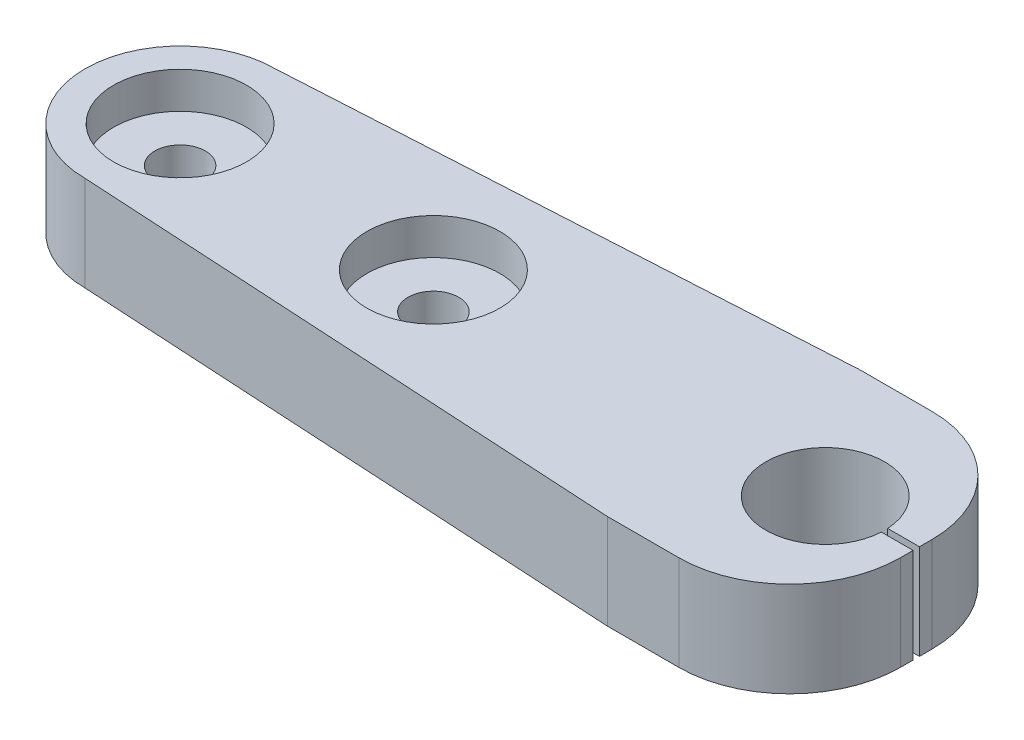
from build123d import *

# Parameters (mm, degrees)
SKETCH1_R                                        = 1.5
BOSS_EXTRUDE1_DEPTH                              = 6
CBORE_FOR_M3_HEX_HEAD_MACHINE_SCREW1_D           = 3.2
CBORE_FOR_M3_HEX_HEAD_MACHINE_SCREW1_DEPTH       = 6
CBORE_FOR_M3_HEX_HEAD_MACHINE_SCREW1_CBORE_D     = 8.4
CBORE_FOR_M3_HEX_HEAD_MACHINE_SCREW1_CBORE_DEPTH = 2.3


with BuildPart() as part:
    # Sketch1 → Boss-Extrude1 (new body)
    with BuildSketch(Plane(origin=(0, 0, 0), x_dir=(1, 0, 0), z_dir=(0, 1, 0))):
        with BuildLine():
            Line((11.5, 10.2), (11.5, 11))
            ThreePointArc((11.5, 11), (9.449747468, 15.949747468), (4.5, 18))
            Line((4.5, 18), (0, 18))
            Line((0, 18), (-35, 16))
            ThreePointArc((-35, 16), (-41, 10), (-35, 4))
            Line((-35, 4), (0, 2))
            Line((0, 2), (4.5, 2))
            ThreePointArc((4.5, 2), (9.449747468, 4.050252532), (11.5, 9))
            Line((11.5, 9), (11.5, 9.8))
            Line((11.5, 9.8), (9.494662869, 9.8))
            ThreePointArc((9.494662869, 9.8), (2, 10), (9.494662869, 10.2))
            Line((9.494662869, 10.2), (11.5, 10.2))
        make_face()
        with Locations(Location((-35, 10, 0), (0, 0, 270))):
            Circle(SKETCH1_R, mode=Mode.SUBTRACT)
        with Locations(Location((-19, 10, 0), (0, 0, 270))):
            Circle(SKETCH1_R, mode=Mode.SUBTRACT)
    extrude(amount=BOSS_EXTRUDE1_DEPTH)

    # CBORE for M3 Hex Head Machine Screw1
    with Locations(Plane(origin=(0, 6, 0), x_dir=(1, 0, 0), z_dir=(0, 1, 0))):
        with Locations((-19, 10), (-35, 10)):
            CounterBoreHole(CBORE_FOR_M3_HEX_HEAD_MACHINE_SCREW1_D / 2, CBORE_FOR_M3_HEX_HEAD_MACHINE_SCREW1_CBORE_D / 2, CBORE_FOR_M3_HEX_HEAD_MACHINE_SCREW1_CBORE_DEPTH, depth=CBORE_FOR_M3_HEX_HEAD_MACHINE_SCREW1_DEPTH)


solid = part.part
